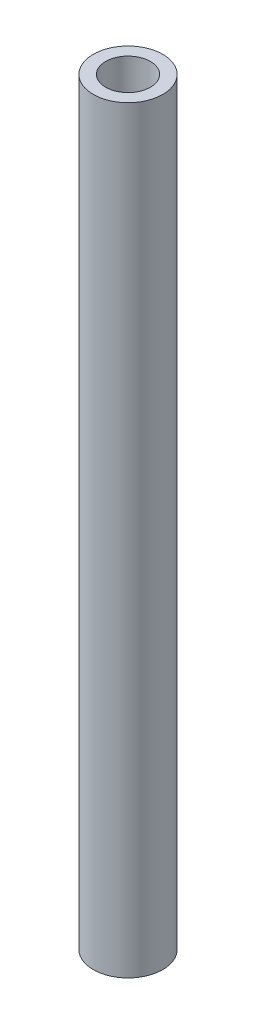
from build123d import *

# Parameters (mm, degrees)
SCHIZZO1_R                   = 2.485
ESTRUSIONE_ESTRUSIONE1_DEPTH = 54.2
FORO_PER_VITE_M3_1_D         = 3.2
FORO_PER_VITE_M3_1_DEPTH     = 11
FORO_PER_VITE_M3_1_TIP       = 0.96137699


with BuildPart() as part:
    # Schizzo1 → Estrusione-Estrusione1 (new body)
    with BuildSketch(Plane(origin=(0, 0, 0), x_dir=(1, 0, 0), z_dir=(0, 1, 0))):
        with Locations(Location((0, 0, 0), (0, 0, 90))):
            Circle(SCHIZZO1_R)
    extrude(amount=ESTRUSIONE_ESTRUSIONE1_DEPTH)

    # Foro per Vite M3-1
    with Locations(Plane(origin=(0, 54.2, 0), x_dir=(1, 0, 0), z_dir=(0, 1, 0))):
        with Locations((0, 0)):
            Hole(FORO_PER_VITE_M3_1_D / 2, depth=FORO_PER_VITE_M3_1_DEPTH)
            with Locations((0, 0, -(FORO_PER_VITE_M3_1_DEPTH + FORO_PER_VITE_M3_1_TIP / 2))):  # 118° drill point
                Cone(0, FORO_PER_VITE_M3_1_D / 2, FORO_PER_VITE_M3_1_TIP, mode=Mode.SUBTRACT)


solid = part.part
